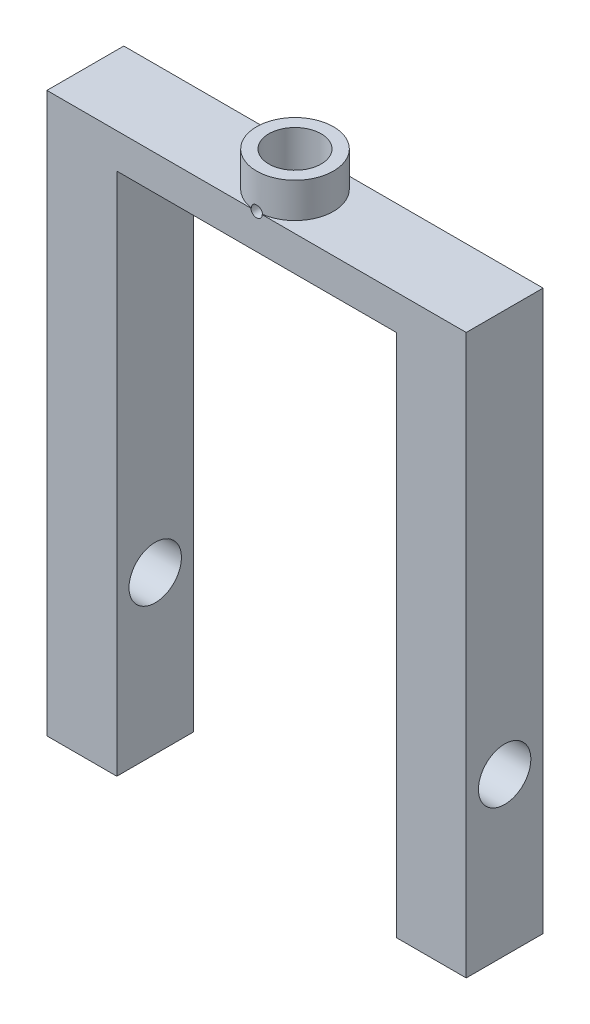
from build123d import *

# Parameters (mm, degrees)
SKETCH1_R               = 6.985
BOSS_EXTRUDE1_DEPTH     = 6.35
SKETCH3_R               = 4.7625
CUT_EXTRUDE1_DEPTH      = 63.5
SKETCH5_W               = 76.2
SKETCH5_H               = 13.97
BOSS_EXTRUDE2_DEPTH     = 101.6
SKETCH6_W               = 50.8
SKETCH6_H               = 95.25
CUT_EXTRUDE2_DEPTH      = 116.325510621
SKETCH7_R               = 4.7625
CUT_EXTRUDE3_DEPTH      = 115.689156964
CUT_EXTRUDE4_DEPTH      = 126.436209784
CUT_EXTRUDE4_DEPTH_BACK = 19.05
SKETCH8_R               = 4.7625
CUT_EXTRUDE5_START      = -13.97
SKETCH9_R               = 1.016
CUT_EXTRUDE5_DEPTH      = 13.97


with BuildPart() as part:
    # Sketch1 → Boss-Extrude1 (new body)
    with BuildSketch(Plane(origin=(0, 0, 0), x_dir=(1, 0, 0), z_dir=(0, 1, 0))):
        with Locations(Location((0, 0, 0), (0, 0, 270))):
            Circle(SKETCH1_R)
    extrude(amount=-BOSS_EXTRUDE1_DEPTH)

    # Sketch3 → Cut-Extrude1 (cut)
    with BuildSketch(Plane(origin=(0, 0, 0), x_dir=(1, 0, 0), z_dir=(0, 1, 0))):
        with Locations(Location((0, 0, 0), (0, 0, 270))):
            Circle(SKETCH3_R)
    extrude(amount=-CUT_EXTRUDE1_DEPTH, mode=Mode.SUBTRACT)

    # Sketch5 → Boss-Extrude2 (add)
    with BuildSketch(Plane(origin=(0, -6.35, 0), x_dir=(-1, 0, 0), z_dir=(0, -1, 0))):
        Rectangle(SKETCH5_W, SKETCH5_H)
    extrude(amount=BOSS_EXTRUDE2_DEPTH)

    # Sketch6 → Cut-Extrude2 (cut, through all)
    with BuildSketch(Plane(origin=(0, 0, -6.985), x_dir=(-1, 0, 0), z_dir=(0, 0, -1))):
        with Locations((0, -60.325)):
            Rectangle(SKETCH6_W, SKETCH6_H)
    extrude(amount=-CUT_EXTRUDE2_DEPTH, mode=Mode.SUBTRACT)

    # Sketch7 → Cut-Extrude3 (cut, through all)
    with BuildSketch(Plane(origin=(0, 0, 0), x_dir=(1, 0, 0), z_dir=(0, 1, 0))):
        with Locations(Location((0, 0, 0), (0, 0, 270))):
            Circle(SKETCH7_R)
    extrude(amount=-CUT_EXTRUDE3_DEPTH, mode=Mode.SUBTRACT)

    # Sketch8 → Cut-Extrude4 (cut, two sides: drawn at the far end of the back side and taken through both)
    with BuildSketch(Plane.ZY.offset(-25.4).offset(-CUT_EXTRUDE4_DEPTH_BACK)):
        with Locations((0, -79.375)):
            Circle(SKETCH8_R)
    extrude(amount=CUT_EXTRUDE4_DEPTH + CUT_EXTRUDE4_DEPTH_BACK, mode=Mode.SUBTRACT)

    # Sketch9 → Cut-Extrude5 (cut)
    with BuildSketch(Plane.XY.offset(6.985).offset(CUT_EXTRUDE5_START)):
        with Locations(Location((0, -6.35, 0), (0, 0, 90))):
            Circle(SKETCH9_R)
    extrude(amount=CUT_EXTRUDE5_DEPTH, mode=Mode.SUBTRACT)


solid = part.part
